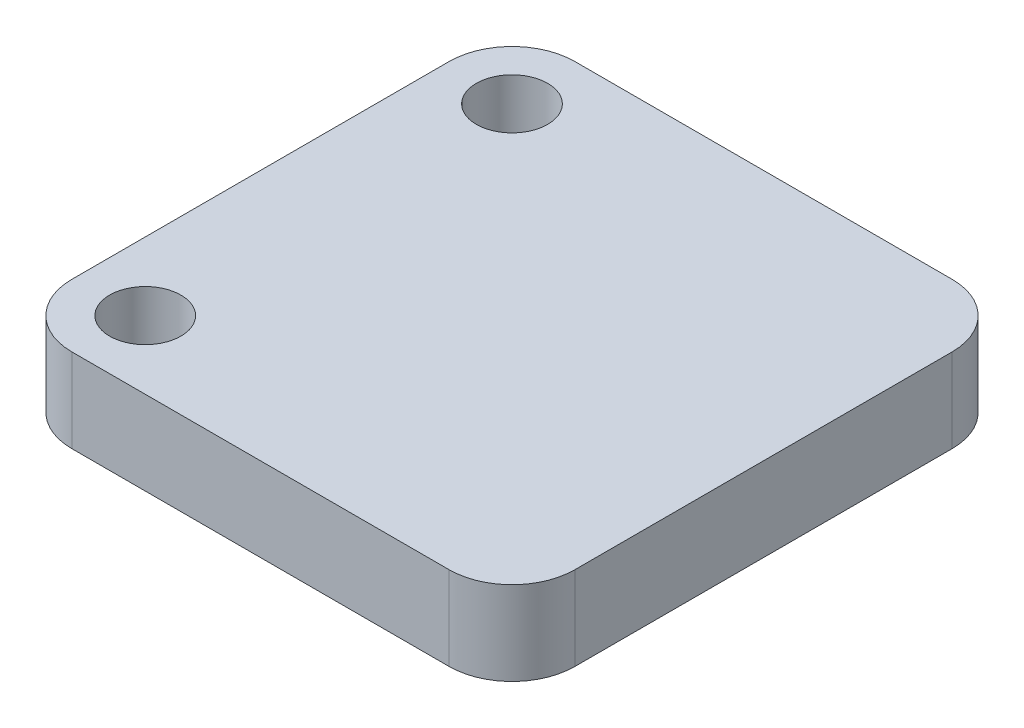
from build123d import *

# Parameters (mm, degrees)
ESQUISSE1_W        = 24
ESQUISSE1_H        = 24
BOSS_EXTRU_1_DEPTH = 4
D_GAGEMENT_M31_D   = 3.4
CONG_1_R           = 3


with BuildPart() as part:
    # Esquisse1 → Boss.-Extru.1 (new body)
    with BuildSketch(Plane(origin=(0, 0, 0), x_dir=(1, 0, 0), z_dir=(0, 1, 0))):
        Rectangle(ESQUISSE1_W, ESQUISSE1_H)
    extrude(amount=BOSS_EXTRU_1_DEPTH)

    # Dégagement M31 (through all)
    with Locations(Plane(origin=(0, 4, 0), x_dir=(1, 0, 0), z_dir=(0, 1, 0))):
        with Locations((-8.75, -8.75), (-8.75, 8.75)):
            Hole(D_GAGEMENT_M31_D / 2)

    # Congé1
    cong_1_edges = [part.edges().sort_by_distance(p)[0] for p in [
        (12, 2, 12),
        (-12, 2, 12),
        (-12, 2, -12),
        (12, 2, -12),
    ]]
    fillet(cong_1_edges, radius=CONG_1_R)


solid = part.part
